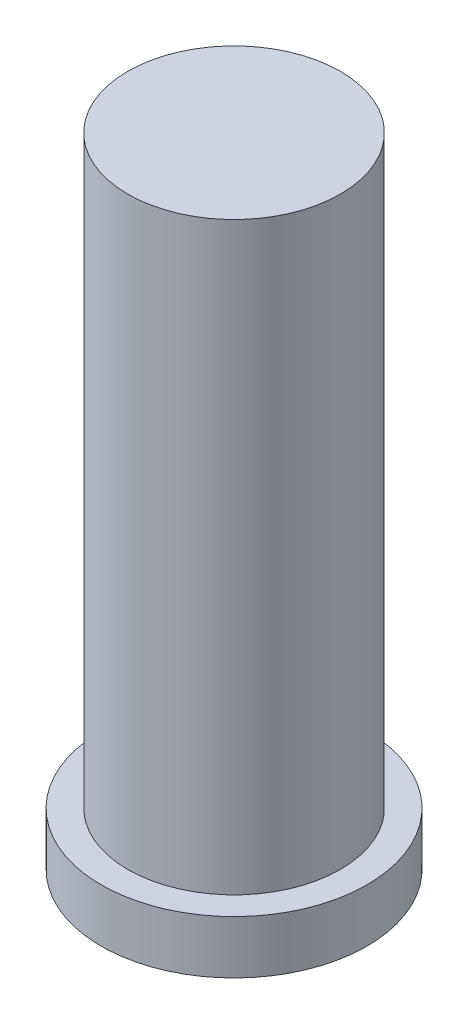
from build123d import *

# Parameters (mm, degrees)
SKETCH1_R           = 4
BOSS_EXTRUDE1_DEPTH = 22
SKETCH2_R           = 5
BOSS_EXTRUDE3_DEPTH = 2


with BuildPart() as part:
    # Sketch1 → Boss-Extrude1 (new body)
    with BuildSketch(Plane(origin=(0, 0, 0), x_dir=(1, 0, 0), z_dir=(0, 1, 0))):
        with Locations(Location((0, 0, 0), (0, 0, 270))):
            Circle(SKETCH1_R)
    extrude(amount=BOSS_EXTRUDE1_DEPTH)

    # Sketch2 → Boss-Extrude3 (add)
    with BuildSketch(Plane.XZ):
        with Locations(Location((0, 0, 0), (0, 0, 270))):
            Circle(SKETCH2_R)
    extrude(amount=BOSS_EXTRUDE3_DEPTH)


solid = part.part
